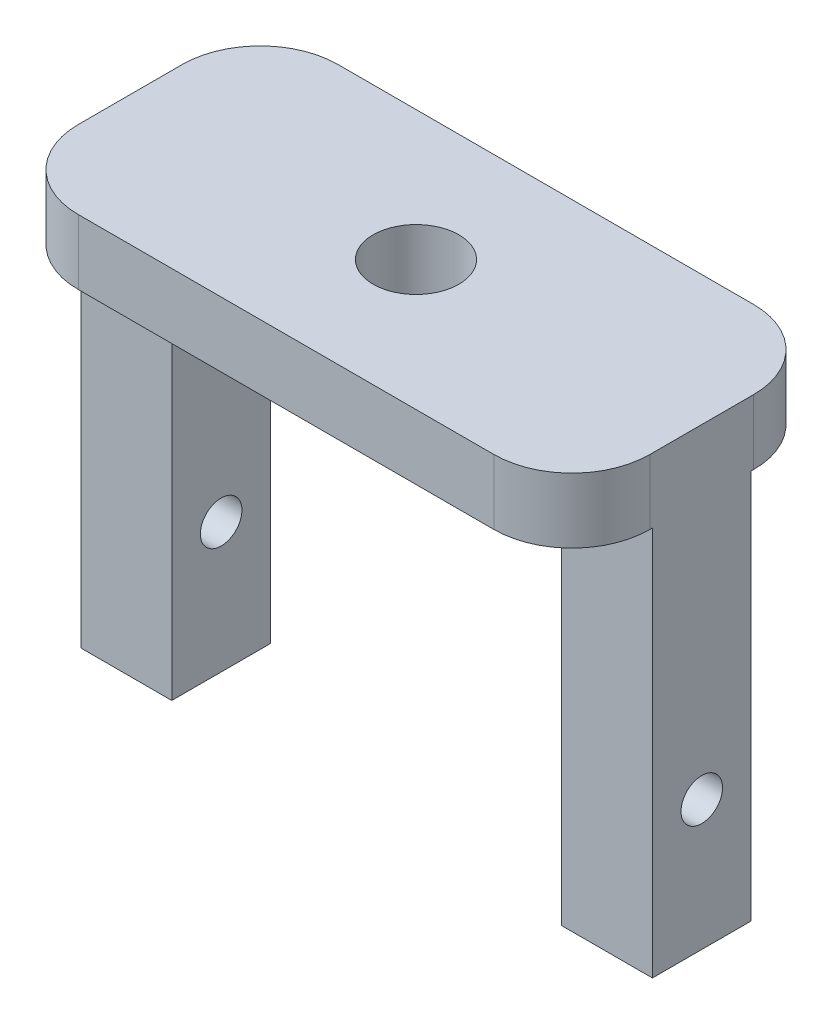
from build123d import *

# Parameters (mm, degrees)
SKETCH_1_W          = 44
SKETCH_1_H          = 20
EXTRUDE_1_DEPTH     = 5
SKETCH_2_W          = 7
SKETCH_2_H          = 7.6
EXTRUDE_2_DEPTH     = 30
SKETCH_3_R          = 3.3
CUT_EXTRUDE_1_DEPTH = 39.522720569
FILLET_1_R          = 6
SKETCH_4_R          = 1.6
CUT_EXTRUDE_2_DEPTH = 58.105166141


with BuildPart() as part:
    # 草图1 → 凸台-拉伸1 (new body)
    with BuildSketch(Plane(origin=(0, 0, 0), x_dir=(1, 0, 0), z_dir=(0, 1, 0))):
        Rectangle(SKETCH_1_W, SKETCH_1_H)
    extrude(amount=-EXTRUDE_1_DEPTH)

    # 草图2 → 凸台-拉伸2 (add)
    with BuildSketch(Plane.XZ.offset(5)):
        with Locations((-18.5, 0)):
            Rectangle(SKETCH_2_W, SKETCH_2_H)
        with Locations((18.5, 0)):
            Rectangle(SKETCH_2_W, SKETCH_2_H)
    extrude(amount=EXTRUDE_2_DEPTH)

    # 草图3 → 切除-拉伸1 (cut, through all)
    with BuildSketch(Plane.XZ.offset(5)):
        with Locations(Location((0, 0, 0), (0, 0, 270))):
            Circle(SKETCH_3_R)
    extrude(amount=-CUT_EXTRUDE_1_DEPTH, mode=Mode.SUBTRACT)

    # 圆角1
    fillet_1_edges = [part.edges().sort_by_distance(p)[0] for p in [
        (22, -2.5, 10),
        (-22, -2.5, 10),
        (-22, -2.5, -10),
        (22, -2.5, -10),
    ]]
    fillet(fillet_1_edges, radius=FILLET_1_R)

    # 草图4 → 切除-拉伸2 (cut, through all)
    with BuildSketch(Plane(origin=(22, 0, 0), x_dir=(0, 0, -1), z_dir=(1, 0, 0))):
        with Locations((0, -25)):
            Circle(SKETCH_4_R)
    extrude(amount=-CUT_EXTRUDE_2_DEPTH, mode=Mode.SUBTRACT)


solid = part.part
